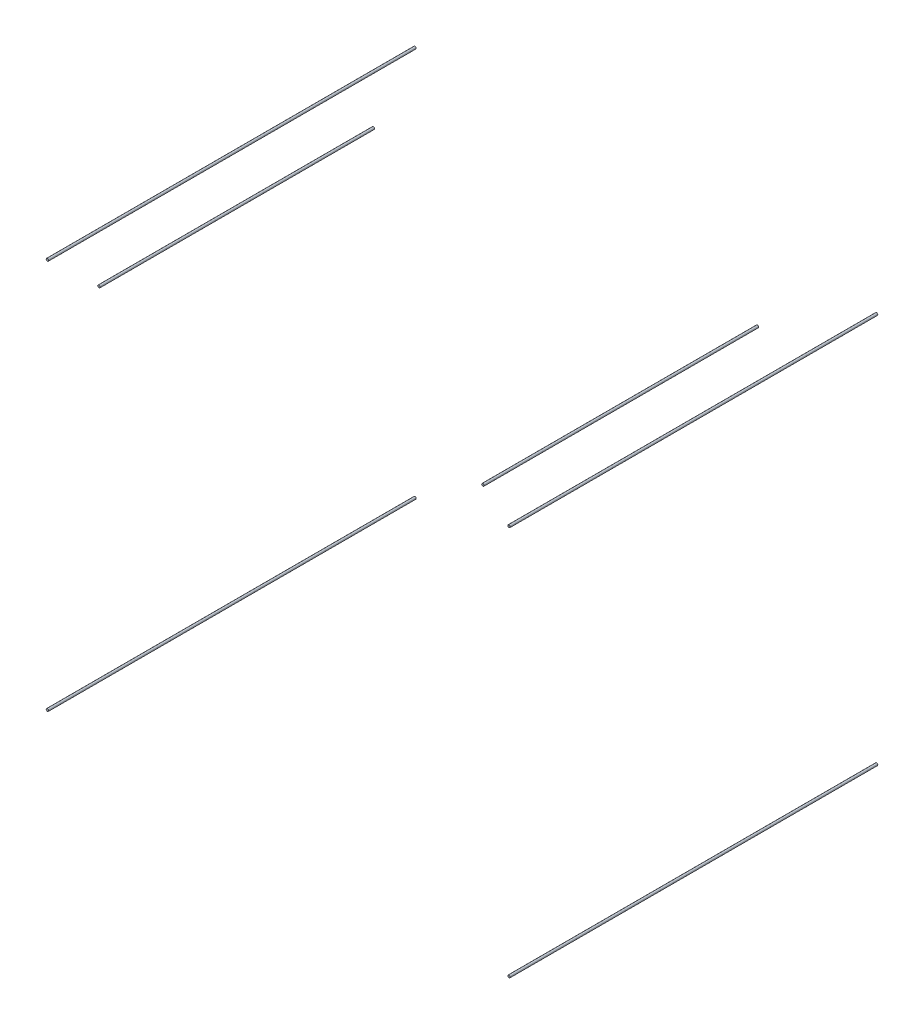
from build123d import *

# Parameters (mm, degrees)
SKETCH1_R      = 0.15
LINE_1_DEPTH   = 46.2
LINE_1_2_DEPTH = 46.2
LINE_1_3_DEPTH = 46.2
LINE_1_4_DEPTH = 46.2
SKETCH2_R      = 0.15
LINE_2_DEPTH   = 34.5
LINE_2_2_DEPTH = 34.5


with BuildPart() as part:
    # Sketch1 → Line_1 (new body)
    with BuildSketch(Plane.XY):
        with Locations((3.5, 3.5)):
            Circle(SKETCH1_R)
    extrude(amount=LINE_1_DEPTH)


with BuildPart() as body_2:
    # Sketch1 → Line_1 2 (new body)
    with BuildSketch(Plane.XY):
        with Locations((61.5, 3.5)):
            Circle(SKETCH1_R)
    extrude(amount=LINE_1_2_DEPTH)


with BuildPart() as body_3:
    # Sketch1 → Line_1 3 (new body)
    with BuildSketch(Plane.XY):
        with Locations((3.5, 52.5)):
            Circle(SKETCH1_R)
    extrude(amount=LINE_1_3_DEPTH)


with BuildPart() as body_4:
    # Sketch1 → Line_1 4 (new body)
    with BuildSketch(Plane.XY):
        with Locations((61.5, 52.5)):
            Circle(SKETCH1_R)
    extrude(amount=LINE_1_4_DEPTH)


with BuildPart() as body_5:
    # Sketch2 → Line_2 (new body)
    with BuildSketch(Plane.XY.offset(10.1)):
        with Locations((8.37, 51.23)):
            Circle(SKETCH2_R)
    extrude(amount=LINE_2_DEPTH)


with BuildPart() as body_6:
    # Sketch2 → Line_2 2 (new body)
    with BuildSketch(Plane.XY.offset(10.1)):
        with Locations((56.63, 53.77)):
            Circle(SKETCH2_R)
    extrude(amount=LINE_2_2_DEPTH)


solid = Compound([part.part, body_2.part, body_3.part, body_4.part, body_5.part, body_6.part])
